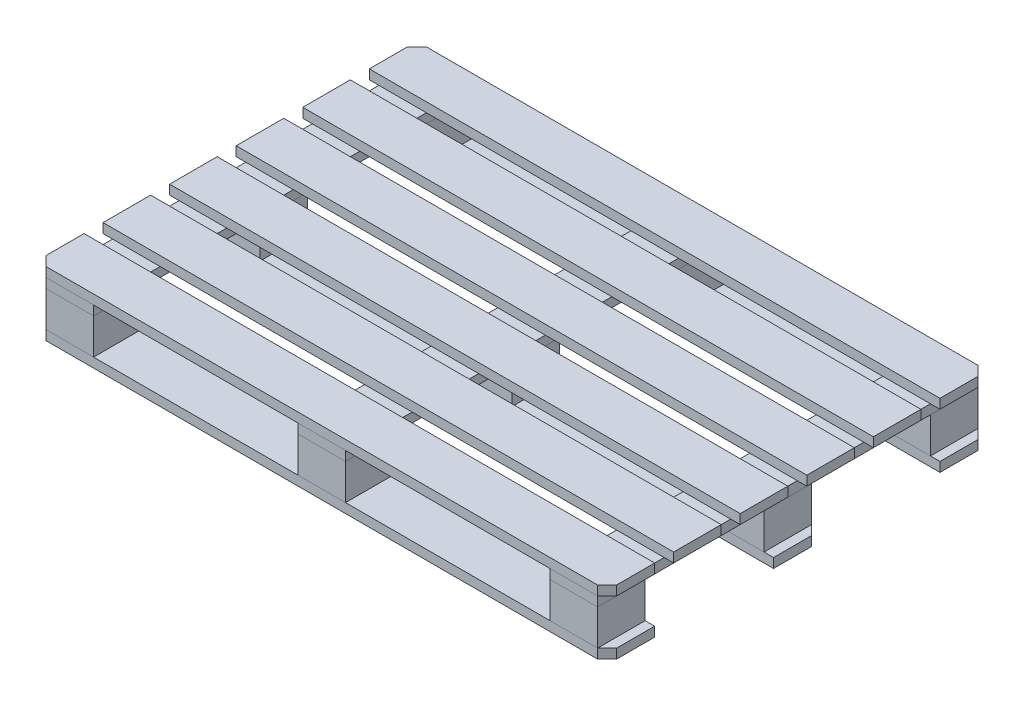
from build123d import *

# Parameters (mm, degrees)
ESQUISSE1_W          = 1200
ESQUISSE1_H          = 100
BOSS_EXTRU_1_DEPTH   = 20
BOSS_EXTRU_1_2_DEPTH = 20
BOSS_EXTRU_1_3_DEPTH = 20
BOSS_EXTRU_1_4_DEPTH = 20
BOSS_EXTRU_1_5_DEPTH = 20
BOSS_EXTRU_1_6_DEPTH = 20
CHANFREIN1_SIZE      = 20
CHANFREIN2_SIZE      = 20
ESQUISSE2_W          = 100
ESQUISSE2_H          = 800
BOSS_EXTRU_2_DEPTH   = 20
BOSS_EXTRU_2_2_DEPTH = 20
BOSS_EXTRU_2_3_DEPTH = 20
ESQUISSE3_W          = 100
ESQUISSE3_H          = 100
BOSS_EXTRU_3_DEPTH   = 75
BOSS_EXTRU_3_2_DEPTH = 75
BOSS_EXTRU_3_3_DEPTH = 75
BOSS_EXTRU_3_4_DEPTH = 75
BOSS_EXTRU_3_5_DEPTH = 75
BOSS_EXTRU_3_6_DEPTH = 75
BOSS_EXTRU_3_7_DEPTH = 75
BOSS_EXTRU_3_8_DEPTH = 75
BOSS_EXTRU_3_9_DEPTH = 75
BOSS_EXTRU_4_DEPTH   = 20
BOSS_EXTRU_4_2_DEPTH = 20
BOSS_EXTRU_4_3_DEPTH = 20


with BuildPart() as part:
    # Esquisse1 → Boss.-Extru.1 (new body)
    with BuildSketch(Plane(origin=(0, 0, 0), x_dir=(1, 0, 0), z_dir=(0, 1, 0))):
        with Locations((0, 350)):
            Rectangle(ESQUISSE1_W, ESQUISSE1_H)
    extrude(amount=BOSS_EXTRU_1_DEPTH)

    # Chanfrein2
    chanfrein2_edges = [part.edges().sort_by_distance(p)[0] for p in [
        (-600, 10, -400),
        (600, 10, -400),
    ]]
    chamfer(chanfrein2_edges, length=CHANFREIN2_SIZE)


with BuildPart() as body_2:
    # Esquisse1 → Boss.-Extru.1 2 (new body)
    with BuildSketch(Plane(origin=(0, 0, 0), x_dir=(1, 0, 0), z_dir=(0, 1, 0))):
        with Locations((0, 210)):
            Rectangle(ESQUISSE1_W, ESQUISSE1_H)
    extrude(amount=BOSS_EXTRU_1_2_DEPTH)


with BuildPart() as body_3:
    # Esquisse1 → Boss.-Extru.1 3 (new body)
    with BuildSketch(Plane(origin=(0, 0, 0), x_dir=(1, 0, 0), z_dir=(0, 1, 0))):
        with Locations((0, 70)):
            Rectangle(ESQUISSE1_W, ESQUISSE1_H)
    extrude(amount=BOSS_EXTRU_1_3_DEPTH)


with BuildPart() as body_4:
    # Esquisse1 → Boss.-Extru.1 4 (new body)
    with BuildSketch(Plane(origin=(0, 0, 0), x_dir=(1, 0, 0), z_dir=(0, 1, 0))):
        with Locations((0, -70)):
            Rectangle(ESQUISSE1_W, ESQUISSE1_H)
    extrude(amount=BOSS_EXTRU_1_4_DEPTH)


with BuildPart() as body_5:
    # Esquisse1 → Boss.-Extru.1 5 (new body)
    with BuildSketch(Plane(origin=(0, 0, 0), x_dir=(1, 0, 0), z_dir=(0, 1, 0))):
        with Locations((0, -210)):
            Rectangle(ESQUISSE1_W, ESQUISSE1_H)
    extrude(amount=BOSS_EXTRU_1_5_DEPTH)


with BuildPart() as body_6:
    # Esquisse1 → Boss.-Extru.1 6 (new body)
    with BuildSketch(Plane(origin=(0, 0, 0), x_dir=(1, 0, 0), z_dir=(0, 1, 0))):
        with Locations((0, -350)):
            Rectangle(ESQUISSE1_W, ESQUISSE1_H)
    extrude(amount=BOSS_EXTRU_1_6_DEPTH)

    # Chanfrein1
    chanfrein1_edges = [body_6.edges().sort_by_distance(p)[0] for p in [
        (-600, 10, 400),
        (600, 10, 400),
    ]]
    chamfer(chanfrein1_edges, length=CHANFREIN1_SIZE)


with BuildPart() as body_7:
    # Esquisse2 → Boss.-Extru.2 (new body)
    with BuildSketch(Plane(origin=(0, 0, 0), x_dir=(1, 0, 0), z_dir=(0, 1, 0))):
        with Locations((-530, 0)):
            Rectangle(ESQUISSE2_W, ESQUISSE2_H)
    extrude(amount=-BOSS_EXTRU_2_DEPTH)


with BuildPart() as body_8:
    # Esquisse2 → Boss.-Extru.2 2 (new body)
    with BuildSketch(Plane(origin=(0, 0, 0), x_dir=(1, 0, 0), z_dir=(0, 1, 0))):
        Rectangle(ESQUISSE2_W, ESQUISSE2_H)
    extrude(amount=-BOSS_EXTRU_2_2_DEPTH)


with BuildPart() as body_9:
    # Esquisse2 → Boss.-Extru.2 3 (new body)
    with BuildSketch(Plane(origin=(0, 0, 0), x_dir=(1, 0, 0), z_dir=(0, 1, 0))):
        with Locations((530, 0)):
            Rectangle(ESQUISSE2_W, ESQUISSE2_H)
    extrude(amount=-BOSS_EXTRU_2_3_DEPTH)


with BuildPart() as body_10:
    # Esquisse3 → Boss.-Extru.3 (new body)
    with BuildSketch(Plane.XZ.offset(20)):
        with Locations((-530, 350)):
            Rectangle(ESQUISSE3_W, ESQUISSE3_H)
    extrude(amount=BOSS_EXTRU_3_DEPTH)


with BuildPart() as body_11:
    # Esquisse3 → Boss.-Extru.3 2 (new body)
    with BuildSketch(Plane.XZ.offset(20)):
        with Locations((0, 350)):
            Rectangle(ESQUISSE3_W, ESQUISSE3_H)
    extrude(amount=BOSS_EXTRU_3_2_DEPTH)


with BuildPart() as body_12:
    # Esquisse3 → Boss.-Extru.3 3 (new body)
    with BuildSketch(Plane.XZ.offset(20)):
        with Locations((530, 350)):
            Rectangle(ESQUISSE3_W, ESQUISSE3_H)
    extrude(amount=BOSS_EXTRU_3_3_DEPTH)


with BuildPart() as body_13:
    # Esquisse3 → Boss.-Extru.3 4 (new body)
    with BuildSketch(Plane.XZ.offset(20)):
        with Locations((530, -350)):
            Rectangle(ESQUISSE3_W, ESQUISSE3_H)
    extrude(amount=BOSS_EXTRU_3_4_DEPTH)


with BuildPart() as body_14:
    # Esquisse3 → Boss.-Extru.3 5 (new body)
    with BuildSketch(Plane.XZ.offset(20)):
        with Locations((0, -350)):
            Rectangle(ESQUISSE3_W, ESQUISSE3_H)
    extrude(amount=BOSS_EXTRU_3_5_DEPTH)


with BuildPart() as body_15:
    # Esquisse3 → Boss.-Extru.3 6 (new body)
    with BuildSketch(Plane.XZ.offset(20)):
        with Locations((-530, -350)):
            Rectangle(ESQUISSE3_W, ESQUISSE3_H)
    extrude(amount=BOSS_EXTRU_3_6_DEPTH)


with BuildPart() as body_16:
    # Esquisse3 → Boss.-Extru.3 7 (new body)
    with BuildSketch(Plane.XZ.offset(20)):
        with Locations((-530, 0)):
            Rectangle(ESQUISSE3_W, ESQUISSE3_H)
    extrude(amount=BOSS_EXTRU_3_7_DEPTH)


with BuildPart() as body_17:
    # Esquisse3 → Boss.-Extru.3 8 (new body)
    with BuildSketch(Plane.XZ.offset(20)):
        with Locations((530, 0)):
            Rectangle(ESQUISSE3_W, ESQUISSE3_H)
    extrude(amount=BOSS_EXTRU_3_8_DEPTH)


with BuildPart() as body_18:
    # Esquisse3 → Boss.-Extru.3 9 (new body)
    with BuildSketch(Plane.XZ.offset(20)):
        Rectangle(ESQUISSE3_W, ESQUISSE3_H)
    extrude(amount=BOSS_EXTRU_3_9_DEPTH)


with BuildPart() as body_19:
    # Esquisse4 → Boss.-Extru.4 (new body)
    with BuildSketch(Plane.XZ.offset(95)):
        Polygon((580, 400), (-580, 400), (-600, 380), (-600, 300), (600, 300), (600, 380), align=None)
    extrude(amount=BOSS_EXTRU_4_DEPTH)


with BuildPart() as body_20:
    # Esquisse4 → Boss.-Extru.4 2 (new body)
    with BuildSketch(Plane.XZ.offset(95)):
        Polygon((600, -380), (580, -400), (-580, -400), (-600, -380), (-600, -300), (600, -300), align=None)
    extrude(amount=BOSS_EXTRU_4_2_DEPTH)


with BuildPart() as body_21:
    # Esquisse4 → Boss.-Extru.4 3 (new body)
    with BuildSketch(Plane.XZ.offset(95)):
        Polygon((580, -50), (-580, -50), (-600, -30), (-600, 50), (600, 50), (600, -30), align=None)
    extrude(amount=BOSS_EXTRU_4_3_DEPTH)


solid = Compound([part.part, body_2.part, body_3.part, body_4.part, body_5.part, body_6.part, body_7.part, body_8.part, body_9.part, body_10.part, body_11.part, body_12.part, body_13.part, body_14.part, body_15.part, body_16.part, body_17.part, body_18.part, body_19.part, body_20.part, body_21.part])
